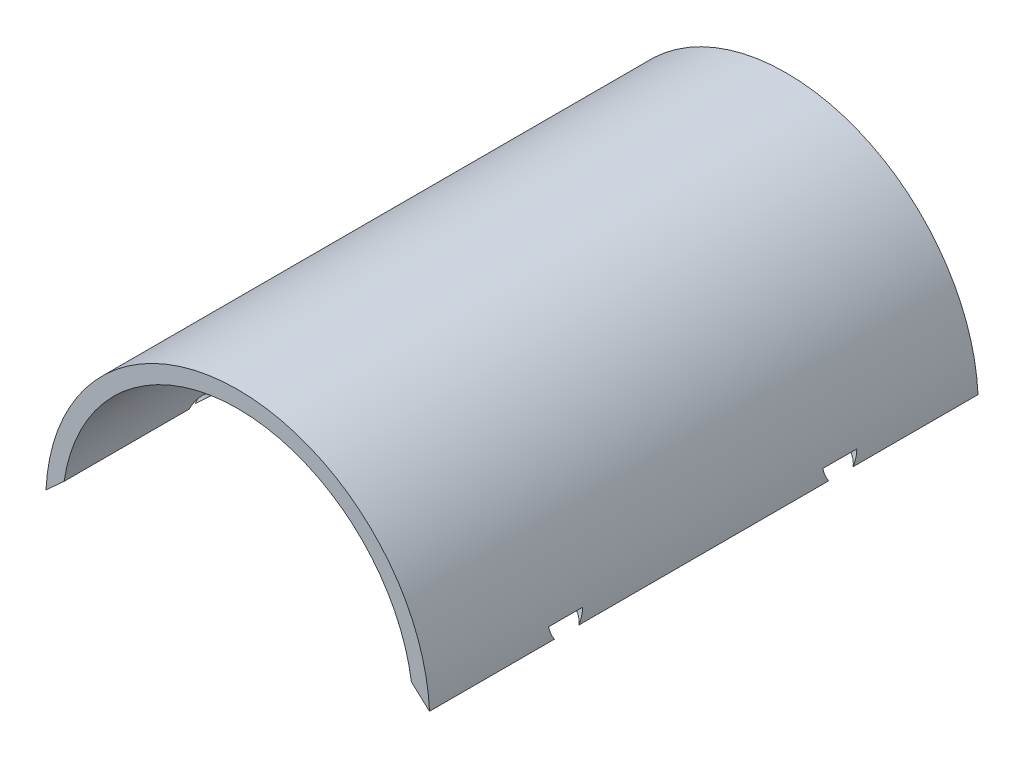
from build123d import *

# Parameters (mm, degrees)
BOSS_EXTRUDE1_DEPTH = 127
SKETCH2_R           = 4
CUT_EXTRUDE1_DEPTH  = 2
SKETCH3_R           = 4
CUT_EXTRUDE2_DEPTH  = 2


with BuildPart() as part:
    # Sketch1 → Boss-Extrude1 (new body)
    with BuildSketch(Plane.XY):
        with BuildLine():
            Line((-40.203883769, 5.937788296), (-44.399042974, 2.127788296))
            ThreePointArc((-44.399042974, 2.127788296), (0, 44.45), (44.399042974, 2.127788296))
            Line((44.399042974, 2.127788296), (40.203883769, 5.937788296))
            ThreePointArc((40.203883769, 5.937788296), (0, 40.64), (-40.203883769, 5.937788296))
        make_face()
    extrude(amount=BOSS_EXTRUDE1_DEPTH)

    # Sketch2 → Cut-Extrude1 (cut)
    with BuildSketch(Plane(origin=(-21.127225221, 23.263011377, 0), x_dir=(0.7402720771062569, 0.6723074087475075, 0), z_dir=(0.6723074087475075, -0.7402720771062569, 0))):
        with Locations((-28.603318705, 95.25)):
            Circle(SKETCH2_R)
        with Locations((-28.603318705, 31.75)):
            Circle(SKETCH2_R)
    extrude(amount=-CUT_EXTRUDE1_DEPTH, mode=Mode.SUBTRACT)

    # Sketch3 → Cut-Extrude2 (cut)
    with BuildSketch(Plane(origin=(21.127225221, 23.263011377, 0), x_dir=(0.7402720771062569, -0.6723074087475075, 0), z_dir=(-0.6723074087475075, -0.7402720771062569, 0))):
        with Locations((28.603318705, 95.25)):
            Circle(SKETCH3_R)
        with Locations((28.603318705, 31.75)):
            Circle(SKETCH3_R)
    extrude(amount=-CUT_EXTRUDE2_DEPTH, mode=Mode.SUBTRACT)


solid = part.part
